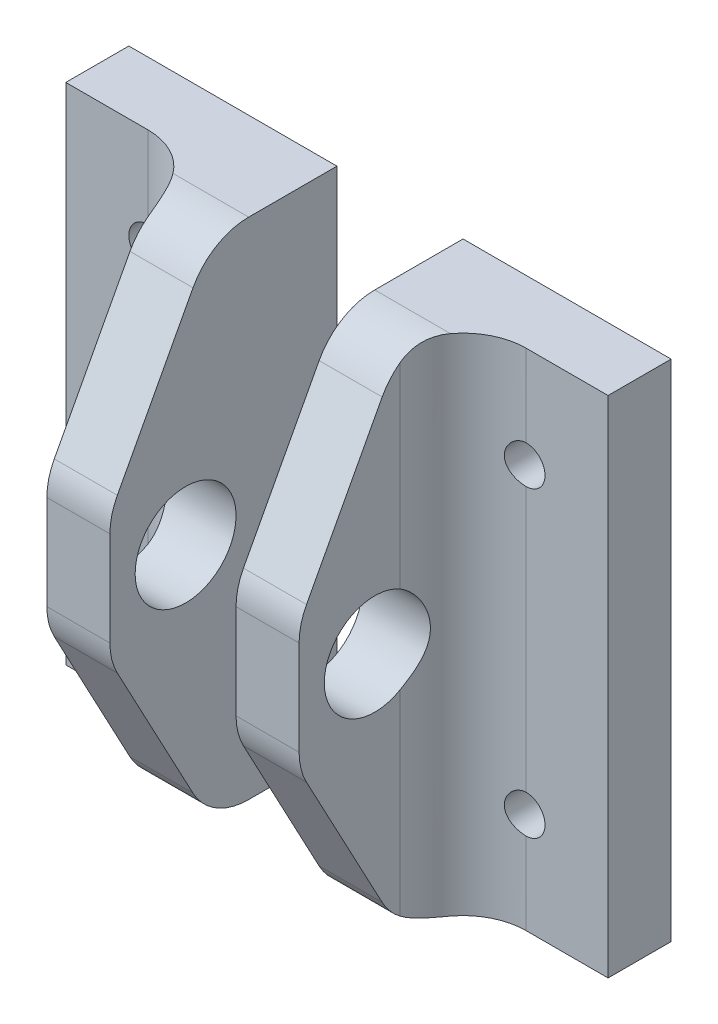
from build123d import *

# Parameters (mm, degrees)
BOSS_EXTRUDE1_DEPTH     = 20
BOSS_EXTRUDE1_2_DEPTH   = 20
CUT_EXTRUDE1_DEPTH      = 42.427647773
CUT_EXTRUDE1_DEPTH_BACK = 42.427647773
SKETCH2_R               = 4
CUT_EXTRUDE2_DEPTH      = 35.441980257
CUT_EXTRUDE2_DEPTH_BACK = 35.441980257
SKETCH3_R               = 1.5
CUT_EXTRUDE3_DEPTH      = 42.427647865
CUT_EXTRUDE3_DEPTH_BACK = 42.427647865
FILLET2_R               = 5
FILLET3_R               = 5


with BuildPart() as part:
    # Sketch1 → Boss-Extrude1 (new, symmetric)
    with BuildSketch(Plane(origin=(0, 0, 0), x_dir=(1, 0, 0), z_dir=(0, 1, 0))):
        with BuildLine():
            Line((-5, 18), (-5, 0))
            Line((-5, 0), (-10, 0))
            Line((-10, 0), (-10, 8))
            ThreePointArc((-10, 8), (-11.464466094, 11.535533906), (-15, 13))
            Line((-15, 13), (-21.5, 13))
            Line((-21.5, 13), (-21.5, 18))
            Line((-21.5, 18), (-5, 18))
        make_face()
    extrude(amount=BOSS_EXTRUDE1_DEPTH, both=True)


with BuildPart() as body_2:
    # Sketch1 → Boss-Extrude1 2 (new, symmetric)
    with BuildSketch(Plane(origin=(0, 0, 0), x_dir=(1, 0, 0), z_dir=(0, 1, 0))):
        with BuildLine():
            Line((21.5, 18), (5, 18))
            Line((5, 18), (5, 0))
            Line((5, 0), (10, 0))
            Line((10, 0), (10, 8))
            ThreePointArc((10, 8), (11.464466094, 11.535533906), (15, 13))
            Line((15, 13), (21.5, 13))
            Line((21.5, 13), (21.5, 18))
        make_face()
    extrude(amount=BOSS_EXTRUDE1_2_DEPTH, both=True)


with BuildPart() as cut_extrude1_tool:
    # Sketch2 → Cut-Extrude1 (new, two sides: drawn at the far end of the back side and taken through both)
    with BuildSketch(Plane(origin=(10, 0, 0), x_dir=(0, 0, -1), z_dir=(1, 0, 0)).offset(-CUT_EXTRUDE1_DEPTH_BACK)):
        with Locations((6, 0)):
            Circle(SKETCH2_R)
    extrude(amount=CUT_EXTRUDE1_DEPTH + CUT_EXTRUDE1_DEPTH_BACK)


with BuildPart() as part_1:
    add(part.part)

    # Cut-Extrude1: cut by cut_extrude1_tool
    add(cut_extrude1_tool.part, mode=Mode.SUBTRACT)


with BuildPart() as body_2_1:
    add(body_2.part)

    # Cut-Extrude1: cut by cut_extrude1_tool
    add(cut_extrude1_tool.part, mode=Mode.SUBTRACT)


with BuildPart() as cut_extrude2_tool:
    # Sketch3 → Cut-Extrude2 (new, two sides: drawn at the far end of the back side and taken through both)
    with BuildSketch(Plane(origin=(0, 0, -18), x_dir=(-1, 0, 0), z_dir=(0, 0, -1)).offset(-CUT_EXTRUDE2_DEPTH_BACK)):
        with Locations(Location((-15, -12, 0), (0, 0, 90))):
            Circle(SKETCH3_R)
        with Locations(Location((-15, 12, 0), (0, 0, 90))):
            Circle(SKETCH3_R)
        with Locations(Location((15, 12, 0), (0, 0, 90))):
            Circle(SKETCH3_R)
        with Locations(Location((15, -12, 0), (0, 0, 90))):
            Circle(SKETCH3_R)
    extrude(amount=CUT_EXTRUDE2_DEPTH + CUT_EXTRUDE2_DEPTH_BACK)


with BuildPart() as part_2:
    add(part_1.part)

    # Cut-Extrude2: cut by cut_extrude2_tool
    add(cut_extrude2_tool.part, mode=Mode.SUBTRACT)


with BuildPart() as body_2_2:
    add(body_2_1.part)

    # Cut-Extrude2: cut by cut_extrude2_tool
    add(cut_extrude2_tool.part, mode=Mode.SUBTRACT)


with BuildPart() as cut_extrude3_tool:
    # Sketch4 → Cut-Extrude3 (new, two sides: drawn at the far end of the back side and taken through both)
    with BuildSketch(Plane(origin=(10, 0, 0), x_dir=(0, 0, -1), z_dir=(1, 0, 0)).offset(-CUT_EXTRUDE3_DEPTH_BACK)):
        Polygon((8, 20), (0, 5), (0, 20), align=None)
        Polygon((8, -20), (0, -5), (0, -20), align=None)
    extrude(amount=CUT_EXTRUDE3_DEPTH + CUT_EXTRUDE3_DEPTH_BACK)


with BuildPart() as part_3:
    add(part_2.part)

    # Cut-Extrude3: cut by cut_extrude3_tool
    add(cut_extrude3_tool.part, mode=Mode.SUBTRACT)

    # Fillet3
    fillet3_edges = [part_3.edges().sort_by_distance(p)[0] for p in [
        (-7.5, -20, -8),
        (-7.5, 20, -8),
        (-7.5, 5, 0),
        (-7.5, -5, 0),
    ]]
    fillet(fillet3_edges, radius=FILLET3_R)


with BuildPart() as body_2_3:
    add(body_2_2.part)

    # Cut-Extrude3: cut by cut_extrude3_tool
    add(cut_extrude3_tool.part, mode=Mode.SUBTRACT)

    # Fillet2
    fillet2_edges = [body_2_3.edges().sort_by_distance(p)[0] for p in [
        (7.5, -20, -8),
        (7.5, 20, -8),
        (7.5, 5, 0),
        (7.5, -5, 0),
    ]]
    fillet(fillet2_edges, radius=FILLET2_R)


solid = Compound([part_3.part, body_2_3.part])
